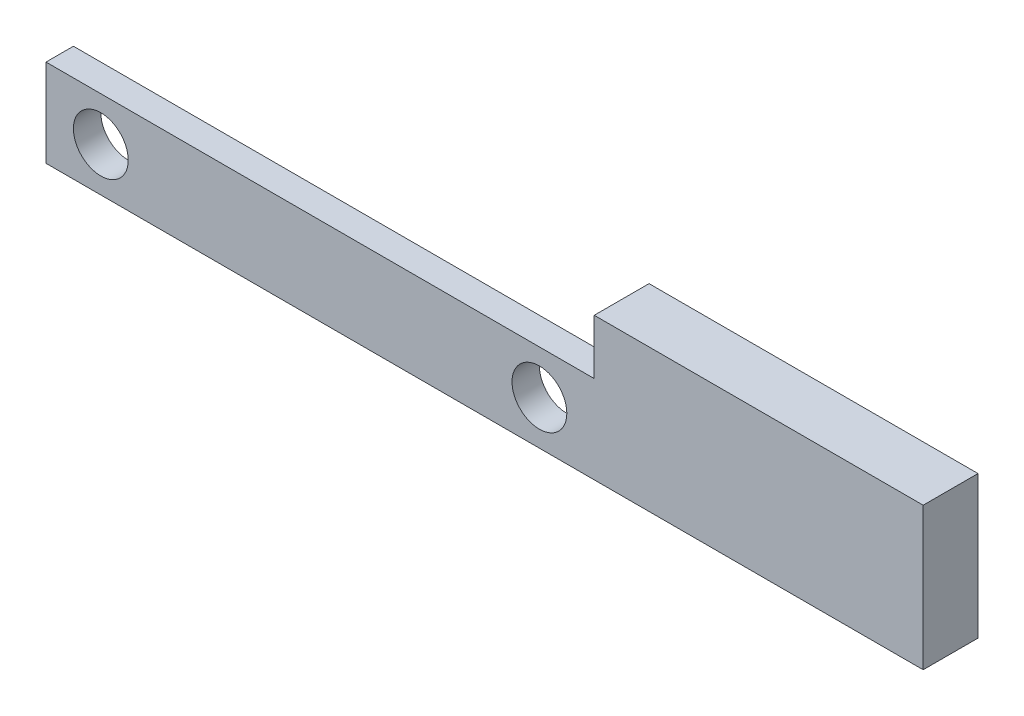
from build123d import *

# Parameters (mm, degrees)
BOSS_EXTRU_1_DEPTH      = 5
ESQUISSE3_R             = 2.5
ENL_V_MAT_EXTRU_1_DEPTH = 5
ESQUISSE5_W             = 50
ESQUISSE5_H             = 8
ENL_V_MAT_EXTRU_3_DEPTH = 2.5


with BuildPart() as part:
    # Esquisse2 → Boss.-Extru.1 (new body)
    with BuildSketch(Plane.XY):
        Polygon((0, 0), (0, 8), (50, 8), (50, 13), (80, 13), (80, 0), align=None)
    extrude(amount=BOSS_EXTRU_1_DEPTH)

    # Esquisse3 → Enlèv. mat.-Extru.1 (cut)
    with BuildSketch(Plane.XY.offset(5)):
        with Locations((5, 4)):
            Circle(ESQUISSE3_R)
        with Locations((45, 4)):
            Circle(ESQUISSE3_R)
    extrude(amount=-ENL_V_MAT_EXTRU_1_DEPTH, mode=Mode.SUBTRACT)

    # Esquisse5 → Enlèv. mat.-Extru.3 (cut)
    with BuildSketch(Plane(origin=(0, 0, 0), x_dir=(-1, 0, 0), z_dir=(0, 0, -1))):
        with Locations((-25, 4)):
            Rectangle(ESQUISSE5_W, ESQUISSE5_H)
    extrude(amount=-ENL_V_MAT_EXTRU_3_DEPTH, mode=Mode.SUBTRACT)


solid = part.part
